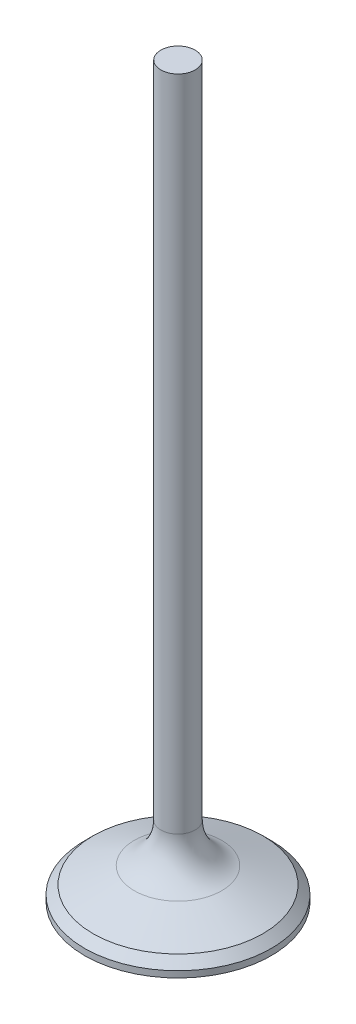
from build123d import *


with BuildPart() as part:
    # Sketch1 → Revolve1 (revolve)
    with BuildSketch(Plane.XY, mode=Mode.PRIVATE) as revolve1_sk:
        with BuildLine():
            Line((0, 0), (14.85, 0))
            Line((14.85, 0), (14.85, 1))
            Line((14.85, 1), (13.5, 2.35))
            Line((13.5, 2.35), (6.951405494, 4.995803923))
            ThreePointArc((6.951405494, 4.995803923), (3.883996385, 7.479742843), (2.73, 11.254294941))
            Line((2.73, 11.254294941), (2.73, 115.95))
            Line((2.73, 115.95), (0, 115.95))
            Line((0, 115.95), (0, 0))
        make_face()
    revolve(revolve1_sk.sketch.rotate(Axis((0, 0, 0), (0, 1, 0)), 90), axis=Axis((0, 0, 0), (0, 1, 0)))


solid = part.part
